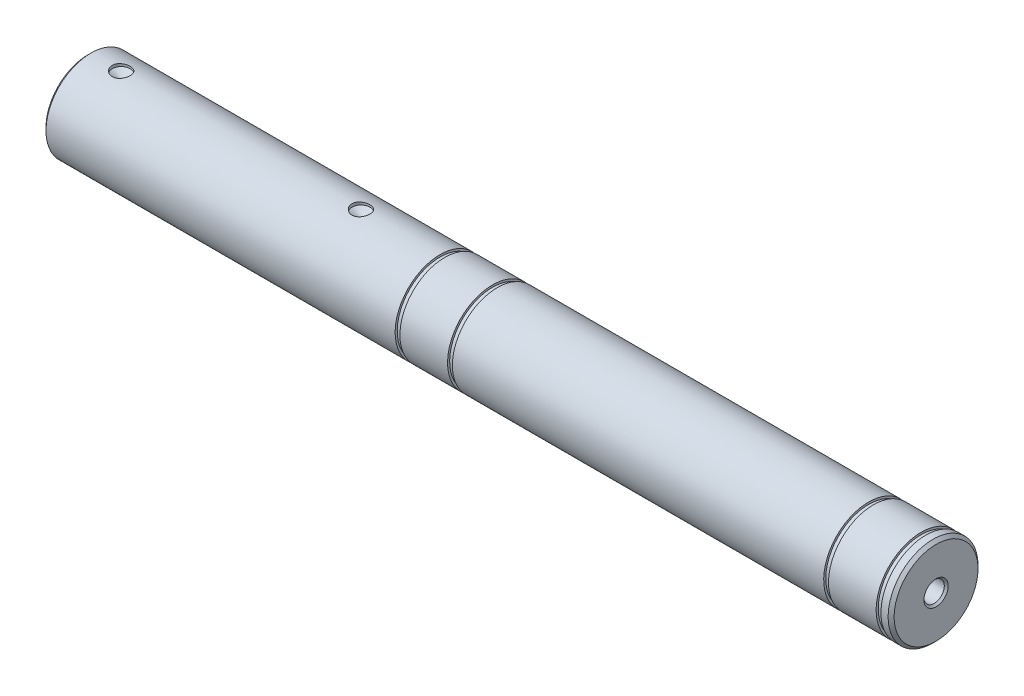
from build123d import *

# Parameters (mm, degrees)
M8_GEWINDEBOHRUNG1_D               = 6.8
M8_GEWINDEBOHRUNG1_DEPTH           = 26.25
M8_GEWINDEBOHRUNG1_CSINK_D         = 8.1
M8_GEWINDEBOHRUNG1_CSINK_ANGLE     = 90
M8_GEWINDEBOHRUNG1_TIP             = 2.042926105
M8_GEWINDEBOHRUNG2_D               = 6.8
M8_GEWINDEBOHRUNG2_DEPTH           = 26.25
M8_GEWINDEBOHRUNG2_CSINK_D         = 8.1
M8_GEWINDEBOHRUNG2_CSINK_ANGLE     = 90
M8_GEWINDEBOHRUNG2_TIP             = 2.042926105
F_6_0_6_DURCHMESSER_BOHRUNG1_D     = 6
F_6_0_6_DURCHMESSER_BOHRUNG1_DEPTH = 1
F_6_0_6_DURCHMESSER_BOHRUNG1_TIP   = 1.802581857


with BuildPart() as part:
    # Skizze1 → Basis-Rotation (revolve)
    with BuildSketch(Plane.XY):
        Polygon((-141.5, 14), (-141.5, 0), (141.5, 0), (141.5, 14), (140.5, 15), (138.1, 15), (138.1, 14.3), (136.5, 14.3), (136.5, 15), (120.6, 15), (120.6, 14.3), (119, 14.3), (119, 15), (-4.9, 15), (-4.9, 14.3), (-6.5, 14.3), (-6.5, 15), (-22.4, 15), (-22.4, 14.3), (-24, 14.3), (-24, 15), (-140.5, 15), align=None)
    revolve(axis=Axis((-241.855208518, 0, 0), (1, 0, 0)))

    # M8 Gewindebohrung1
    with Locations(Plane.ZY.offset(141.5)):
        with Locations((0, 0)):
            CounterSinkHole(M8_GEWINDEBOHRUNG1_D / 2, M8_GEWINDEBOHRUNG1_CSINK_D / 2, depth=M8_GEWINDEBOHRUNG1_DEPTH, counter_sink_angle=M8_GEWINDEBOHRUNG1_CSINK_ANGLE)
            with Locations((0, 0, -(M8_GEWINDEBOHRUNG1_DEPTH + M8_GEWINDEBOHRUNG1_TIP / 2))):  # 118° drill point
                Cone(0, M8_GEWINDEBOHRUNG1_D / 2, M8_GEWINDEBOHRUNG1_TIP, mode=Mode.SUBTRACT)

    # M8 Gewindebohrung2
    with Locations(Plane(origin=(141.5, 0, 0), x_dir=(0, 0, -1), z_dir=(1, 0, 0))):
        with Locations((0, 0)):
            CounterSinkHole(M8_GEWINDEBOHRUNG2_D / 2, M8_GEWINDEBOHRUNG2_CSINK_D / 2, depth=M8_GEWINDEBOHRUNG2_DEPTH, counter_sink_angle=M8_GEWINDEBOHRUNG2_CSINK_ANGLE)
            with Locations((0, 0, -(M8_GEWINDEBOHRUNG2_DEPTH + M8_GEWINDEBOHRUNG2_TIP / 2))):  # 118° drill point
                Cone(0, M8_GEWINDEBOHRUNG2_D / 2, M8_GEWINDEBOHRUNG2_TIP, mode=Mode.SUBTRACT)

    # Ø6.0 (6) Durchmesser Bohrung1
    with Locations(Plane(origin=(0, 15, 0), x_dir=(1, 0, 0), z_dir=(0, 1, 0))):
        with Locations((-50.4, 0), (-130.4, 0)):
            Hole(F_6_0_6_DURCHMESSER_BOHRUNG1_D / 2, depth=F_6_0_6_DURCHMESSER_BOHRUNG1_DEPTH)
            with Locations((0, 0, -(F_6_0_6_DURCHMESSER_BOHRUNG1_DEPTH + F_6_0_6_DURCHMESSER_BOHRUNG1_TIP / 2))):  # 118° drill point
                Cone(0, F_6_0_6_DURCHMESSER_BOHRUNG1_D / 2, F_6_0_6_DURCHMESSER_BOHRUNG1_TIP, mode=Mode.SUBTRACT)


solid = part.part
